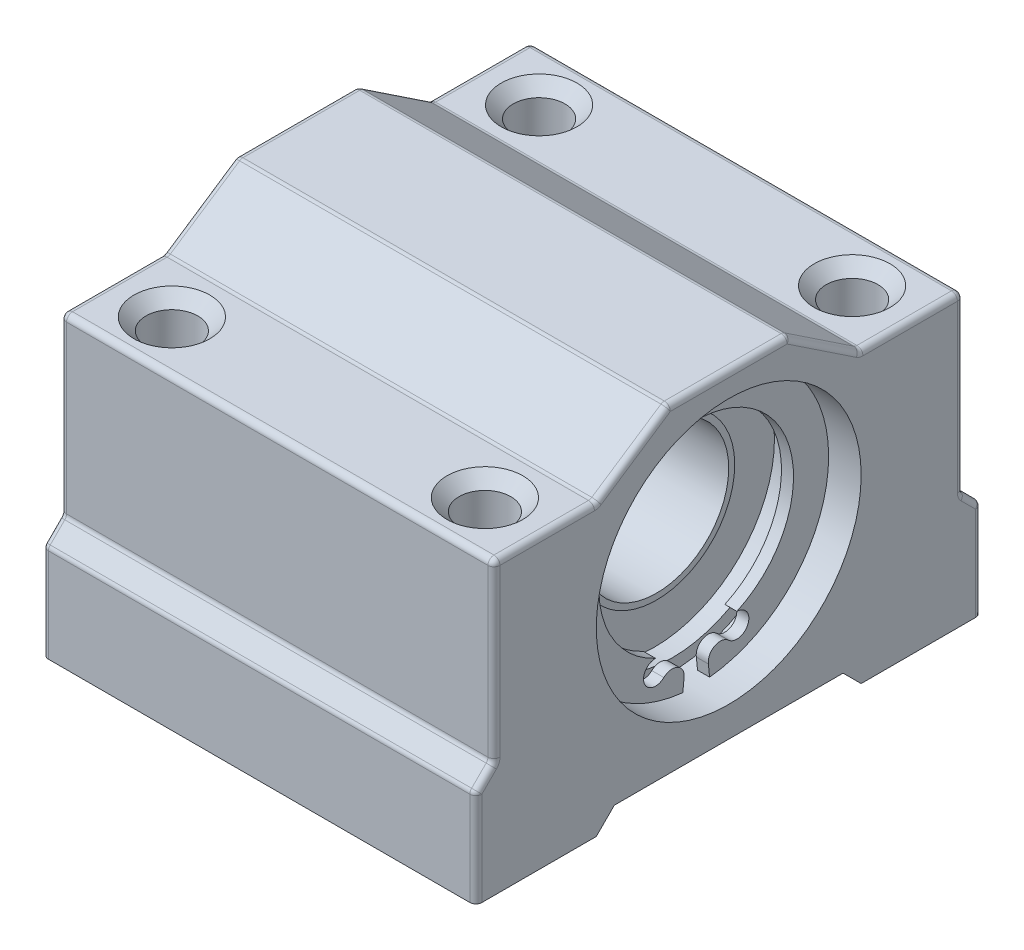
from build123d import *

# Parameters (mm, degrees)
SKETCH1_R           = 11
BOSS_EXTRUDE1_DEPTH = 36
EXTRUDE_THIN1_START = 0.5
SKETCH1_4_R         = 6.5
SKETCH1_4_R_2       = 6
EXTRUDE_THIN1_DEPTH = 29.5
BOSS_EXTRUDE2_START = 0.8
SKETCH1_5_R         = 10
SKETCH1_5_R_2       = 6
BOSS_EXTRUDE2_DEPTH = 29
BOSS_EXTRUDE3_START = 0.3
SKETCH1_6_R         = 11
SKETCH1_6_R_2       = 10
BOSS_EXTRUDE3_DEPTH = 31
BOSS_EXTRUDE4_START = 1
BOSS_EXTRUDE4_DEPTH = 1
FILLET1_R           = 0.5
SKETCH4_R           = 2.15
CUT_EXTRUDE3_DEPTH  = 51.209560914
CHAMFER1_SIZE       = 1


with BuildPart() as part:
    # Sketch1 → Boss-Extrude1 (new body)
    with BuildSketch(Plane(origin=(0, 0, 0), x_dir=(0, 0, -1), z_dir=(1, 0, 0))):
        Polygon((-21, -15), (-11, -15), (-9.5, -13.5), (9.5, -13.5), (11, -15), (21, -15), (21, -7), (19.5, -5.5), (19.5, 9), (11, 9), (5, 13), (-5, 13), (-11, 9), (-19.5, 9), (-19.5, -5.5), (-21, -7), align=None)
        Circle(SKETCH1_R, mode=Mode.SUBTRACT)
    extrude(amount=BOSS_EXTRUDE1_DEPTH)



with BuildPart() as body_2:
    # Sketch1<4> → Extrude-Thin1 (new body)
    with BuildSketch(Plane(origin=(0, 0, 0), x_dir=(0, 0, -1), z_dir=(1, 0, 0)).offset(EXTRUDE_THIN1_START)):
        Circle(SKETCH1_4_R)
        Circle(SKETCH1_4_R_2, mode=Mode.SUBTRACT)
    extrude(amount=EXTRUDE_THIN1_DEPTH)

    # Sketch1<5> → Boss-Extrude2 (add)
    with BuildSketch(Plane(origin=(0, 0, 0), x_dir=(0, 0, -1), z_dir=(1, 0, 0)).offset(BOSS_EXTRUDE2_START)):
        Circle(SKETCH1_5_R)
        Circle(SKETCH1_5_R_2, mode=Mode.SUBTRACT)
    extrude(amount=BOSS_EXTRUDE2_DEPTH)


with BuildPart() as part_1:
    add(part.part)

    add(body_2.part)  # Boss-Extrude3 merges body 2
    # Sketch1<6> → Boss-Extrude3 (add)
    with BuildSketch(Plane(origin=(0, 0, 0), x_dir=(0, 0, -1), z_dir=(1, 0, 0)).offset(BOSS_EXTRUDE3_START)):
        Circle(SKETCH1_6_R)
        Circle(SKETCH1_6_R_2, mode=Mode.SUBTRACT)
    extrude(amount=BOSS_EXTRUDE3_DEPTH)

    # Sketch3 → Boss-Extrude4 (add)
    with BuildSketch(Plane(origin=(31.3, 0, 0), x_dir=(0, 0, -1), z_dir=(1, 0, 0)).offset(BOSS_EXTRUDE4_START)):
        with BuildLine():
            Line((-1.011429614, -9.94871902), (-1.112572576, -10.943590922))
            ThreePointArc((-1.112572576, -10.943590922), (0, 11), (1.112572576, -10.943590922))
            Line((1.112572576, -10.943590922), (1.011429614, -9.94871902))
            ThreePointArc((1.011429614, -9.94871902), (1.535872296, -8.912190675), (2.686623353, -9.070945649))
            ThreePointArc((2.686623353, -9.070945649), (4.301522401, -8.715825098), (3.378506843, -7.343946161))
            ThreePointArc((3.378506843, -7.343946161), (0, 8.083801933), (-3.378506843, -7.343946161))
            ThreePointArc((-3.378506843, -7.343946161), (-4.301522401, -8.715825098), (-2.686623353, -9.070945649))
            ThreePointArc((-2.686623353, -9.070945649), (-1.535872296, -8.912190675), (-1.011429614, -9.94871902))
        make_face()
    extrude(amount=BOSS_EXTRUDE4_DEPTH)

    # Fillet1
    fillet1_edges = [part_1.edges().sort_by_distance(p)[0] for p in [
        (18, -5.5, -19.5),
        (18, -5.5, 19.5),
        (18, -7, 21),
        (18, -7, -21),
        (18, 9, -11),
        (18, 9, 11),
        (18, 13, 5),
        (18, 13, -5),
        (18, 9, -19.5),
        (18, 9, 19.5),
        (36, 11, -8),
        (36, 11, 8),
        (36, 1.75, 19.5),
        (0, -6.25, 20.25),
        (0, 11, 8),
        (36, -6.25, -20.25),
        (36, -11, -21),
        (36, 1.75, -19.5),
        (36, 13, 0),
        (36, 9, -15.25),
        (36, 9, 15.25),
        (36, -6.25, 20.25),
        (36, -11, 21),
        (0, -11, -21),
        (0, -6.25, -20.25),
        (0, 1.75, -19.5),
        (0, 11, -8),
        (0, 9, -15.25),
        (0, 13, 0),
        (0, -11, 21),
        (0, 1.75, 19.5),
        (0, 9, 15.25),
    ]]
    fillet(fillet1_edges, radius=FILLET1_R)

    # Sketch4 → Cut-Extrude3 (cut, through all)
    with BuildSketch(Plane.XZ.offset(15)):
        with Locations((5, 15.25)):
            Circle(SKETCH4_R)
        with Locations((31, 15.25)):
            Circle(SKETCH4_R)
        with Locations((31, -15.25)):
            Circle(SKETCH4_R)
        with Locations((5, -15.25)):
            Circle(SKETCH4_R)
    extrude(amount=-CUT_EXTRUDE3_DEPTH, mode=Mode.SUBTRACT)

    # Chamfer1
    chamfer1_edges = [part_1.edges().sort_by_distance(p)[0] for p in [
        (28.85, 9, -15.25),
        (2.85, 9, -15.25),
        (2.85, 9, 15.25),
        (28.85, 9, 15.25),
        (28.85, -15, 15.25),
        (2.85, -15, 15.25),
        (28.85, -15, -15.25),
        (2.85, -15, -15.25),
    ]]
    chamfer(chamfer1_edges, length=CHAMFER1_SIZE)


solid = part_1.part
